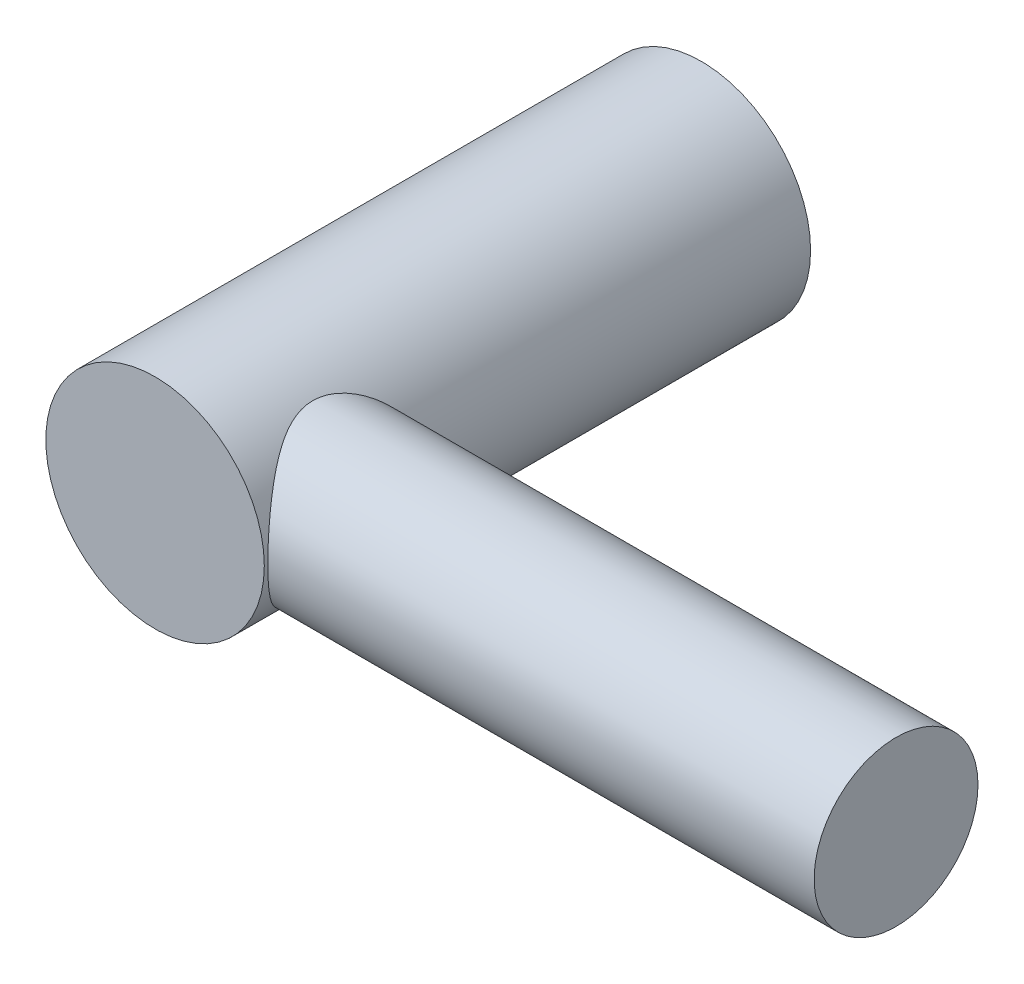
from build123d import *

# Parameters (mm, degrees)
SKETCH1_R           = 25.4
BOSS_EXTRUDE1_DEPTH = 127
SKETCH2_R           = 19.05
BOSS_EXTRUDE2_DEPTH = 152.4


with BuildPart() as part:
    # Sketch1 → Boss-Extrude1 (new body)
    with BuildSketch(Plane.XY):
        Circle(SKETCH1_R)
    extrude(amount=BOSS_EXTRUDE1_DEPTH)

    # Sketch2 → Boss-Extrude2 (add)
    with BuildSketch(Plane(origin=(0, 0, 0), x_dir=(0, 0, -1), z_dir=(1, 0, 0))):
        with Locations((-107.130880808, 0)):
            Circle(SKETCH2_R)
    extrude(amount=BOSS_EXTRUDE2_DEPTH)


solid = part.part
